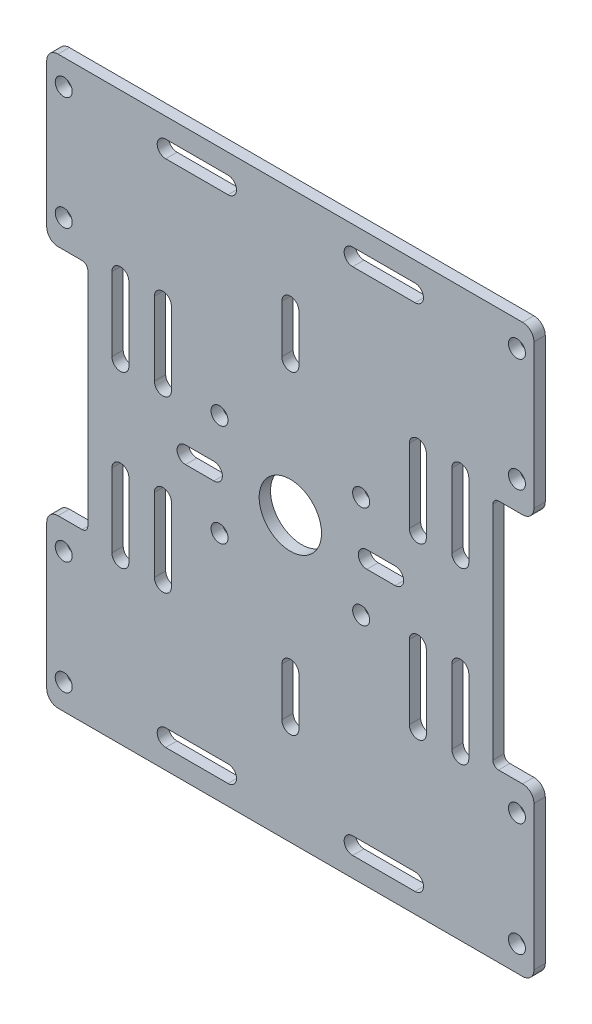
from build123d import *

# Parameters (mm, degrees)
SKETCH_1_R      = 5.5
SKETCH_1_R_2    = 1.5
EXTRUDE_1_DEPTH = 2
FILLET_1_R      = 1
FILLET_2_R      = 2


with BuildPart() as part:
    # 草圖1 → 填料-伸長1 (new body)
    with BuildSketch(Plane.XY):
        Polygon((-35.75, -20.56252042), (-43, -20.56252042), (-43, -50), (-25.75, -50), (25.75, -50), (43, -50), (43, -20.56252042), (35.75, -20.56252042), (35.75, 20.56252042), (43, 20.56252042), (43, 50), (25.75, 50), (-25.75, 50), (-43, 50), (-43, 20.56252042), (-35.75, 20.56252042), align=None)
        Circle(SKETCH_1_R, mode=Mode.SUBTRACT)
        with Locations((12.5, -9)):
            Circle(SKETCH_1_R_2, mode=Mode.SUBTRACT)
        with Locations(Location((-12.5, -9, 0), (0, 0, 180))):
            Circle(SKETCH_1_R_2, mode=Mode.SUBTRACT)
        with Locations(Location((12.5, 9, 0), (0, 0, 180))):
            Circle(SKETCH_1_R_2, mode=Mode.SUBTRACT)
        with Locations((-12.5, 9)):
            Circle(SKETCH_1_R_2, mode=Mode.SUBTRACT)
        with Locations((-40, -25.5)):
            Circle(SKETCH_1_R_2, mode=Mode.SUBTRACT)
        with Locations(Location((40, -25.5, 0), (0, 0, 180))):
            Circle(SKETCH_1_R_2, mode=Mode.SUBTRACT)
        with Locations((40, 25.5)):
            Circle(SKETCH_1_R_2, mode=Mode.SUBTRACT)
        with Locations(Location((-40, 25.5, 0), (0, 0, 180))):
            Circle(SKETCH_1_R_2, mode=Mode.SUBTRACT)
        with Locations((-40, -45.5)):
            Circle(SKETCH_1_R_2, mode=Mode.SUBTRACT)
        with Locations(Location((-40, 45.5, 0), (0, 0, 180))):
            Circle(SKETCH_1_R_2, mode=Mode.SUBTRACT)
        with Locations((40, 45.5)):
            Circle(SKETCH_1_R_2, mode=Mode.SUBTRACT)
        with Locations(Location((40, -45.5, 0), (0, 0, 180))):
            Circle(SKETCH_1_R_2, mode=Mode.SUBTRACT)
        with BuildLine():
            Line((13.5, 1.5), (18.5, 1.5))
            ThreePointArc((18.5, 1.5), (20, 0), (18.5, -1.5))
            Line((18.5, -1.5), (13.5, -1.5))
            ThreePointArc((13.5, -1.5), (12, 0), (13.5, 1.5))
        make_face(mode=Mode.SUBTRACT)
        with BuildLine():
            Line((24, -8.5), (24, -21.5))
            ThreePointArc((24, -21.5), (22.5, -23), (21, -21.5))
            Line((21, -21.5), (21, -8.5))
            ThreePointArc((21, -8.5), (22.5, -7), (24, -8.5))
        make_face(mode=Mode.SUBTRACT)
        with BuildLine():
            Line((31.5, -8.5), (31.5, -21.5))
            ThreePointArc((31.5, -21.5), (30, -23), (28.5, -21.5))
            Line((28.5, -21.5), (28.5, -8.5))
            ThreePointArc((28.5, -8.5), (30, -7), (31.5, -8.5))
        make_face(mode=Mode.SUBTRACT)
        with BuildLine():
            Line((31.5, 8.5), (31.5, 21.5))
            ThreePointArc((31.5, 21.5), (30, 23), (28.5, 21.5))
            Line((28.5, 21.5), (28.5, 8.5))
            ThreePointArc((28.5, 8.5), (30, 7), (31.5, 8.5))
        make_face(mode=Mode.SUBTRACT)
        with BuildLine():
            Line((24, 8.5), (24, 21.5))
            ThreePointArc((24, 21.5), (22.5, 23), (21, 21.5))
            Line((21, 21.5), (21, 8.5))
            ThreePointArc((21, 8.5), (22.5, 7), (24, 8.5))
        make_face(mode=Mode.SUBTRACT)
        with BuildLine():
            Line((-24, 8.5), (-24, 21.5))
            ThreePointArc((-24, 21.5), (-22.5, 23), (-21, 21.5))
            Line((-21, 21.5), (-21, 8.5))
            ThreePointArc((-21, 8.5), (-22.5, 7), (-24, 8.5))
        make_face(mode=Mode.SUBTRACT)
        with BuildLine():
            Line((-31.5, 8.5), (-31.5, 21.5))
            ThreePointArc((-31.5, 21.5), (-30, 23), (-28.5, 21.5))
            Line((-28.5, 21.5), (-28.5, 8.5))
            ThreePointArc((-28.5, 8.5), (-30, 7), (-31.5, 8.5))
        make_face(mode=Mode.SUBTRACT)
        with BuildLine():
            Line((-31.5, -8.5), (-31.5, -21.5))
            ThreePointArc((-31.5, -21.5), (-30, -23), (-28.5, -21.5))
            Line((-28.5, -21.5), (-28.5, -8.5))
            ThreePointArc((-28.5, -8.5), (-30, -7), (-31.5, -8.5))
        make_face(mode=Mode.SUBTRACT)
        with BuildLine():
            Line((-24, -8.5), (-24, -21.5))
            ThreePointArc((-24, -21.5), (-22.5, -23), (-21, -21.5))
            Line((-21, -21.5), (-21, -8.5))
            ThreePointArc((-21, -8.5), (-22.5, -7), (-24, -8.5))
        make_face(mode=Mode.SUBTRACT)
        with BuildLine():
            Line((-22, -43.5), (-11, -43.5))
            ThreePointArc((-11, -43.5), (-9.5, -45), (-11, -46.5))
            Line((-11, -46.5), (-22, -46.5))
            ThreePointArc((-22, -46.5), (-23.5, -45), (-22, -43.5))
        make_face(mode=Mode.SUBTRACT)
        with BuildLine():
            Line((22, -43.5), (11, -43.5))
            ThreePointArc((11, -43.5), (9.5, -45), (11, -46.5))
            Line((11, -46.5), (22, -46.5))
            ThreePointArc((22, -46.5), (23.5, -45), (22, -43.5))
        make_face(mode=Mode.SUBTRACT)
        with BuildLine():
            Line((22, 43.5), (11, 43.5))
            ThreePointArc((11, 43.5), (9.5, 45), (11, 46.5))
            Line((11, 46.5), (22, 46.5))
            ThreePointArc((22, 46.5), (23.5, 45), (22, 43.5))
        make_face(mode=Mode.SUBTRACT)
        with BuildLine():
            Line((-22, 43.5), (-11, 43.5))
            ThreePointArc((-11, 43.5), (-9.5, 45), (-11, 46.5))
            Line((-11, 46.5), (-22, 46.5))
            ThreePointArc((-22, 46.5), (-23.5, 45), (-22, 43.5))
        make_face(mode=Mode.SUBTRACT)
        with BuildLine():
            Line((-13.5, 1.5), (-18.5, 1.5))
            ThreePointArc((-18.5, 1.5), (-20, 0), (-18.5, -1.5))
            Line((-18.5, -1.5), (-13.5, -1.5))
            ThreePointArc((-13.5, -1.5), (-12, 0), (-13.5, 1.5))
        make_face(mode=Mode.SUBTRACT)
        with BuildLine():
            Line((1.5, -23.5), (1.5, -32))
            ThreePointArc((1.5, -32), (0, -33.5), (-1.5, -32))
            Line((-1.5, -32), (-1.5, -23.5))
            ThreePointArc((-1.5, -23.5), (0, -22), (1.5, -23.5))
        make_face(mode=Mode.SUBTRACT)
        with BuildLine():
            Line((1.5, 23.5), (1.5, 32))
            ThreePointArc((1.5, 32), (0, 33.5), (-1.5, 32))
            Line((-1.5, 32), (-1.5, 23.5))
            ThreePointArc((-1.5, 23.5), (0, 22), (1.5, 23.5))
        make_face(mode=Mode.SUBTRACT)
    extrude(amount=EXTRUDE_1_DEPTH)

    # 圓角1
    fillet_1_edges = [part.edges().sort_by_distance(p)[0] for p in [
        (35.75, 20.56252042, 1),
        (35.75, -20.56252042, 1),
        (-35.75, -20.56252042, 1),
        (-35.75, 20.56252042, 1),
    ]]
    fillet(fillet_1_edges, radius=FILLET_1_R)

    # 圓角2
    fillet_2_edges = [part.edges().sort_by_distance(p)[0] for p in [
        (43, 50, 1),
        (43, 20.56252042, 1),
        (43, -20.56252042, 1),
        (43, -50, 1),
        (-43, -50, 1),
        (-43, -20.56252042, 1),
        (-43, 20.56252042, 1),
        (-43, 50, 1),
    ]]
    fillet(fillet_2_edges, radius=FILLET_2_R)


solid = part.part
